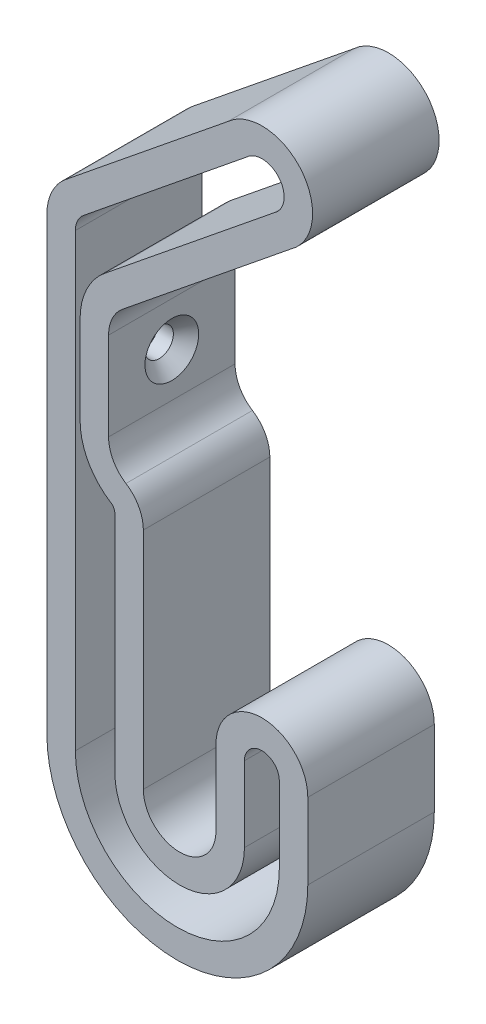
from build123d import *

# Parameters (mm, degrees)
BOSS_EXTRU_1_DEPTH           = 20
ENL_V_MAT_EXTRU_1_DEPTH      = 127.792788454
ENL_V_MAT_EXTRU_1_DEPTH_BACK = 127.792788454
ESQUISSE4_R                  = 2.25
CHANFREIN1_SIZE              = 2


with BuildPart() as part:
    # Esquisse3 → Boss.-Extru.1 (new body)
    with BuildSketch(Plane.XY):
        with BuildLine():
            Line((0, -100.352508149), (0, -29.115804262))
            ThreePointArc((0, -29.115804262), (0.779317725, -25.671715487), (2.965436872, -22.89863657))
            Line((2.965436872, -22.89863657), (28.598971382, -2.141009609))
            ThreePointArc((28.598971382, -2.141009609), (40.22943243, -2.99679919), (38.648412133, -14.551035418))
            Line((38.648412133, -14.551035418), (11.974077654, -36.151485576))
            ThreePointArc((11.974077654, -36.151485576), (10.334488294, -38.231294764), (9.75, -40.814361345))
            Line((9.75, -40.814361345), (9.75, -54.752508149))
            ThreePointArc((9.75, -54.752508149), (10.482858086, -57.605686201), (12.5, -59.752508149))
            ThreePointArc((12.5, -59.752508149), (14.517141914, -61.899330096), (15.25, -64.752508149))
            Line((15.25, -64.752508149), (15.25, -100.252508149))
            ThreePointArc((15.25, -100.252508149), (20.99, -105.992508149), (26.73, -100.252508149))
            Line((26.73, -100.252508149), (26.73, -88.352508149))
            ThreePointArc((26.73, -88.352508149), (33.99, -81.092508149), (41.25, -88.352508149))
            Line((41.25, -88.352508149), (41.25, -100.352508149))
            ThreePointArc((41.25, -100.352508149), (20.625, -120.977508149), (0, -100.352508149))
        make_face()
        with BuildLine():
            Line((4.5, -100.352508149), (4.5, -29.115804262))
            ThreePointArc((4.5, -29.115804262), (4.840951505, -27.609015423), (5.797378631, -26.395793396))
            Line((5.797378631, -26.395793396), (31.562630973, -5.531503439))
            ThreePointArc((31.562630973, -5.531503439), (36.732275603, -5.82874095), (35.948188205, -10.947215595))
            Line((35.948188205, -10.947215595), (9.142135894, -32.654328749))
            ThreePointArc((9.142135894, -32.654328749), (6.272854514, -36.293994828), (5.25, -40.814361345))
            Line((5.25, -40.814361345), (5.25, -54.752508149))
            ThreePointArc((5.25, -54.752508149), (6.539886497, -59.774320575), (10.090211132, -63.552892026))
            ThreePointArc((10.090211132, -63.552892026), (10.574170325, -64.06796447), (10.75, -64.752508149))
            Line((10.75, -64.752508149), (10.75, -100.252508149))
            ThreePointArc((10.75, -100.252508149), (20.99, -110.492508149), (31.23, -100.252508149))
            Line((31.23, -100.252508149), (31.23, -88.352508149))
            ThreePointArc((31.23, -88.352508149), (33.99, -85.592508149), (36.75, -88.352508149))
            Line((36.75, -88.352508149), (36.75, -100.352508149))
            ThreePointArc((36.75, -100.352508149), (20.625, -116.477508149), (4.5, -100.352508149))
        make_face(mode=Mode.SUBTRACT)
    extrude(amount=BOSS_EXTRU_1_DEPTH)

    # Esquisse4 → Enlèv. mat.-Extru.1 (cut, two sides: drawn at the far end of the back side and taken through both)
    with BuildSketch(Plane(origin=(9.75, 0, 0), x_dir=(0, 0, -1), z_dir=(1, 0, 0)).offset(-ENL_V_MAT_EXTRU_1_DEPTH_BACK)):
        with Locations(Location((-10, -47.783434747, 0), (0, 0, 90))):
            Circle(ESQUISSE4_R)
    extrude(amount=ENL_V_MAT_EXTRU_1_DEPTH + ENL_V_MAT_EXTRU_1_DEPTH_BACK, mode=Mode.SUBTRACT)

    # Chanfrein1
    chanfrein1_edges = [part.edges().sort_by_distance(p)[0] for p in [
        (9.75, -50.033434747, 10),
    ]]
    chamfer(chanfrein1_edges, length=CHANFREIN1_SIZE)


solid = part.part
